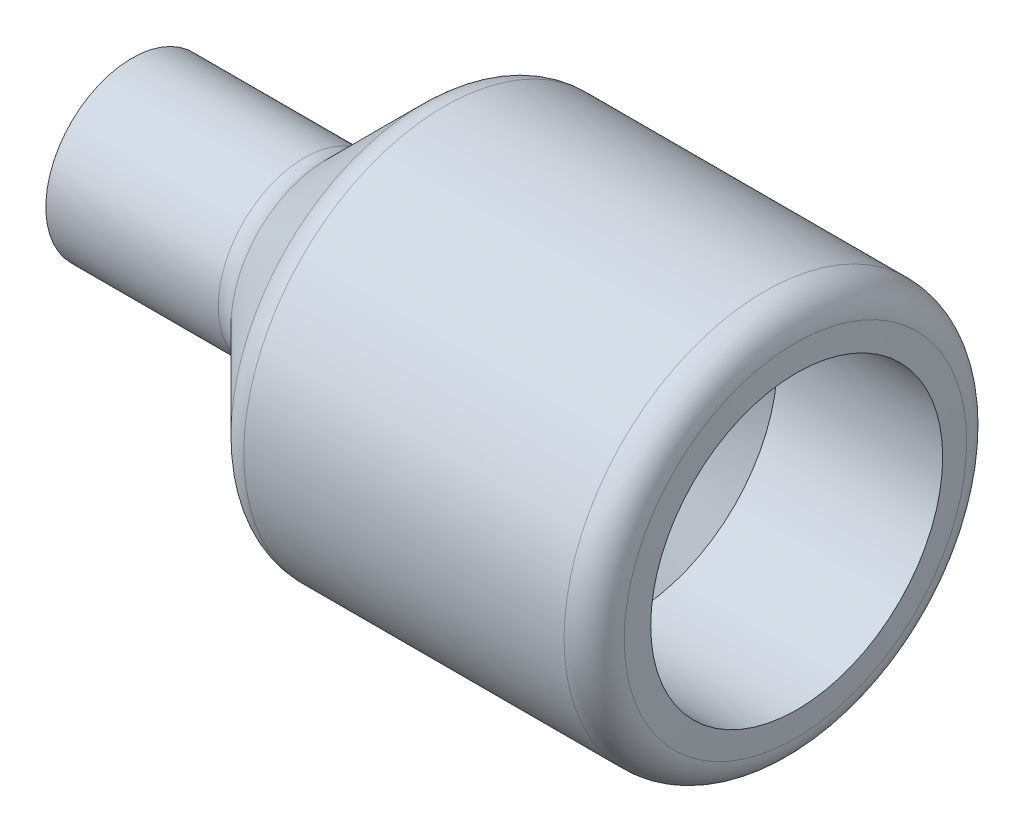
from build123d import *

# Parameters (mm, degrees)
FILLET1_R = 1.27


with BuildPart() as part:
    # Sketch2 → Revolve1 (revolve)
    with BuildSketch(Plane(origin=(-264.677360787, 57.593912348, 41.335049774), x_dir=(-1, 0, 0), z_dir=(0, 0.8834532092441242, 0.4685193988259799)), mode=Mode.PRIVATE) as revolve1_sk:
        Polygon((-96.232, 111.240700647), (-88.612, 111.240700647), (-88.612, 114.784000647), (-103.157789755, 114.784000647), (-109.166789755, 108.775000647), (-115.97310043, 108.775000647), (-115.863170352, 106.529000647), (-100.9437, 106.529000647), align=None)
    revolve(revolve1_sk.sketch.rotate(Axis((-161.519571032, 3.81538137, 142.741343516), (-1, 0, 0)), 27.93823036), axis=Axis((-161.519571032, 3.81538137, 142.741343516), (-1, 0, 0)))

    # Fillet1
    fillet1_edges = [part.edges().sort_by_distance(p)[0] for p in [
        (-168.445360787, 3.81538137, 146.284643516),
        (-163.733660787, 3.81538137, 150.996343516),
        (-148.814190436, 3.81538137, 150.996343516),
    ]]
    fillet(fillet1_edges, radius=FILLET1_R)


solid = part.part
